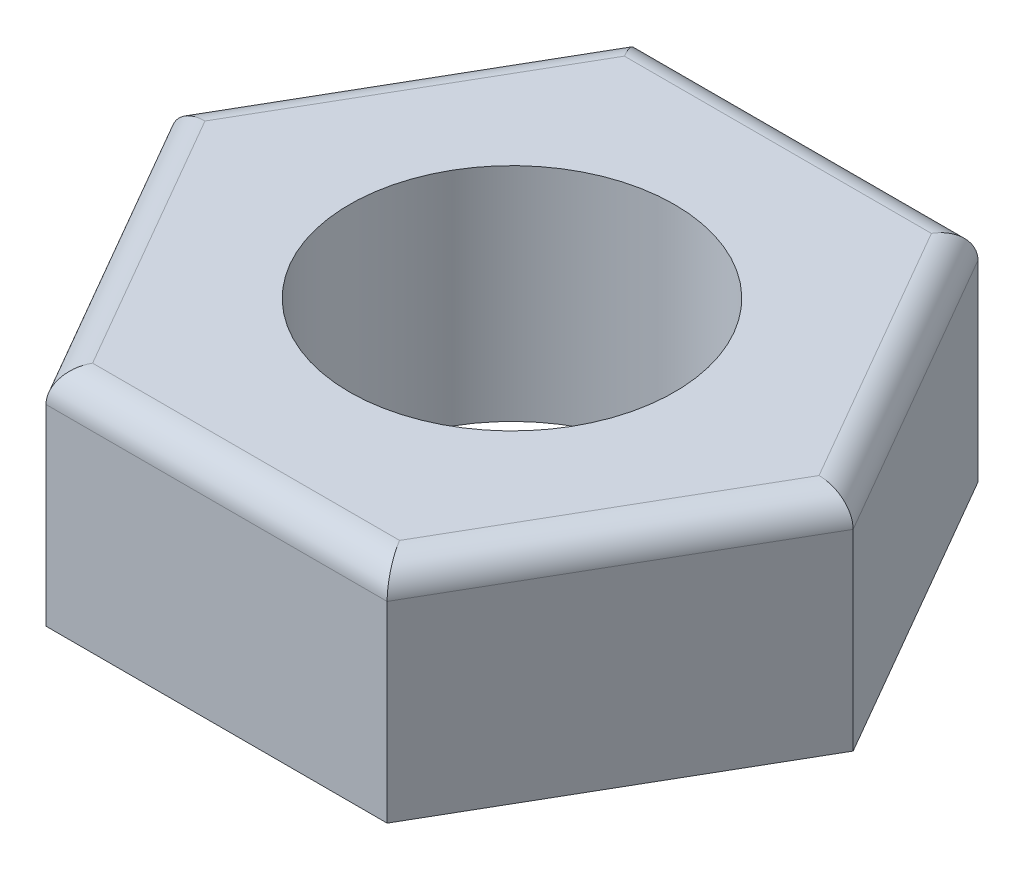
from build123d import *

# Parameters (mm, degrees)
EXTRUDE_1_DEPTH     = 15
SKETCH_2_R          = 11
CUT_EXTRUDE_1_DEPTH = 35.034296428
FILLET_1_R          = 2


with BuildPart() as part:
    # 草图1 → 凸台-拉伸1 (new body)
    with BuildSketch(Plane(origin=(0, 0, 0), x_dir=(1, 0, 0), z_dir=(0, 1, 0))):
        Polygon((-11.547005384, -20), (11.547005384, -20), (23.094010768, 0), (11.547005384, 20), (-11.547005384, 20), (-23.094010768, 0), align=None)
    extrude(amount=EXTRUDE_1_DEPTH)

    # 草图2 → 切除-拉伸1 (cut, through all)
    with BuildSketch(Plane(origin=(0, 15, 0), x_dir=(1, 0, 0), z_dir=(0, 1, 0))):
        with Locations(Location((0, 0, 0), (0, 0, 270))):
            Circle(SKETCH_2_R)
    extrude(amount=-CUT_EXTRUDE_1_DEPTH, mode=Mode.SUBTRACT)

    # 圆角1
    fillet_1_edges = [part.edges().sort_by_distance(p)[0] for p in [
        (17.320508076, 15, 10),
        (17.320508076, 15, -10),
        (0, 15, -20),
        (-17.320508076, 15, -10),
        (-17.320508076, 15, 10),
        (0, 15, 20),
    ]]
    fillet(fillet_1_edges, radius=FILLET_1_R)


solid = part.part
